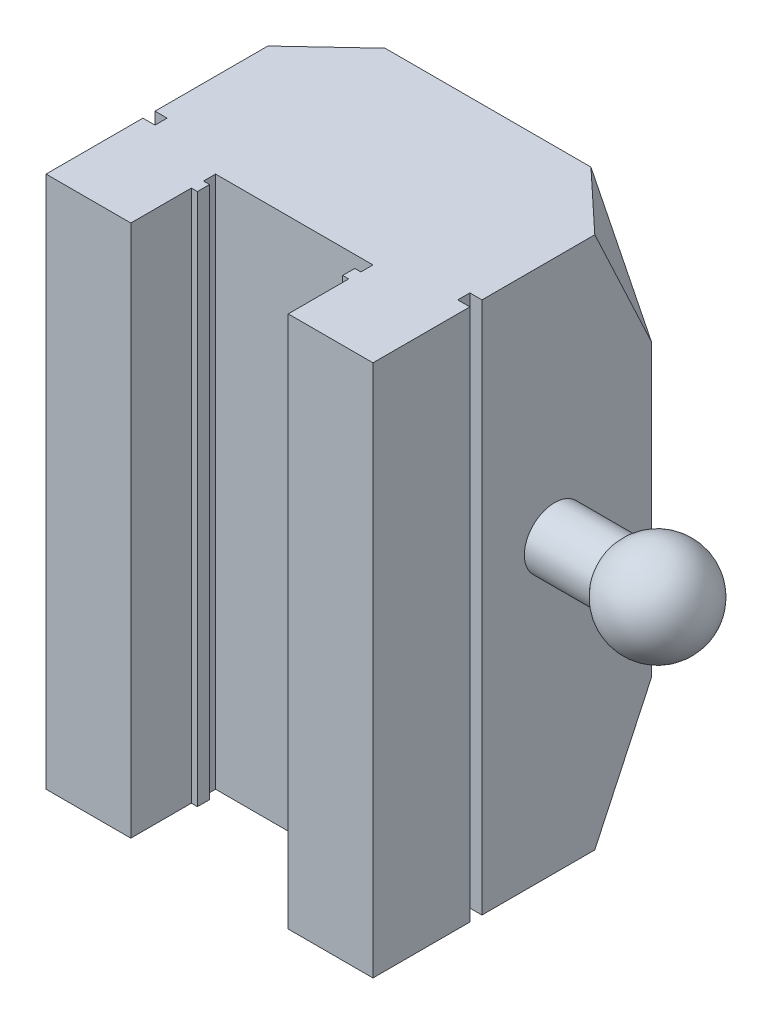
from build123d import *

# Parameters (mm, degrees)
EXTRUDE_1_DEPTH = 44
SKETCH_4_R      = 2.5
EXTRUDE_2_DEPTH = 22


with BuildPart() as part:
    # 草圖1 → 填料-伸長1 (new body)
    with BuildSketch(Plane(origin=(0, 0, 0), x_dir=(1, 0, 0), z_dir=(0, 1, 0))):
        Polygon((-13.5, 0), (-6.5, 0), (-6.5, 5), (-6, 5), (-6, 6), (-6.5, 6), (-6.5, 7), (6.5, 7), (6.5, 6), (6, 6), (6, 5), (6.5, 5), (6.5, 0), (13.5, 0), (13.5, 8), (12.5, 8), (12.5, 9), (13.5, 9), (13.5, 23), (-13.5, 23), (-13.5, 9), (-12.5, 9), (-12.5, 8), (-13.5, 8), align=None)
    extrude(amount=EXTRUDE_1_DEPTH)

    # 除料-掃出1: sweep along a path in 草圖3
    with BuildLine(Plane(origin=(13.5, 0, 0), x_dir=(0, 0, -1), z_dir=(1, 0, 0))) as sweep_1_path:
        Line((23, 34), (18.317914301, 44))
    # 草圖2 → 除料-掃出1 (sweep, cut)
    with BuildSketch(Plane(origin=(0, 0, -23), x_dir=(-1, 0, 0), z_dir=(0, 0, -1))):
        Polygon((-13.5, 44), (-8.5, 44), (-13.5, 34), align=None)
    sweep_1 = sweep(path=sweep_1_path.line, mode=Mode.SUBTRACT)

    # 鏡射1: 除料-掃出1 across plane
    add(sweep_1.mirror(Plane(origin=(0, 0, 0), x_dir=(0, 0, 1), z_dir=(1, 0, 0))), mode=Mode.SUBTRACT)

    # 鏡射2: 除料-掃出1 across plane
    add(sweep_1.mirror(Plane(origin=(0, 22, 0), x_dir=(0, 0, 1), z_dir=(0, -1, 0))), mode=Mode.SUBTRACT)

    # 鏡射2 copy 1: sweep along a path in 鏡射2 copy 1 path
    with BuildLine(Plane(origin=(-13.5, 44, 0), x_dir=(0, 0, -1), z_dir=(-1, 0, 0))) as mirror_2_copy_1_path:
        Line((23, 34), (18.317914301, 44))
    # 鏡射2 copy 1 sketch → 鏡射2 copy 1 (sweep, cut)
    with BuildSketch(Plane(origin=(0, 44, -23), x_dir=(1, 0, 0), z_dir=(0, 0, -1))):
        Polygon((-13.5, 44), (-8.5, 44), (-13.5, 34), align=None)
    sweep(path=mirror_2_copy_1_path.line, mode=Mode.SUBTRACT)

    # 草圖4 → 填料-伸長2 (add, symmetric)
    with BuildSketch(Plane(origin=(0, 0, 0), x_dir=(0, 0, -1), z_dir=(1, 0, 0))):
        with Locations((15, 24)):
            Circle(SKETCH_4_R)
    extrude(amount=EXTRUDE_2_DEPTH, both=True)

    # 草圖5 → 旋轉1 (revolve)
    with BuildSketch(Plane(origin=(22, 0, 0), x_dir=(0, 0, -1), z_dir=(1, 0, 0))):
        with BuildLine():
            Line((15, 28), (15, 20))
            ThreePointArc((15, 20), (19, 24), (15, 28))
        make_face()
    revolve_1 = revolve(axis=Axis((22, 24, -15), (0, 1, 0)))

    # 鏡射3: 旋轉1 across plane
    add(revolve_1.mirror(Plane(origin=(0, 0, 0), x_dir=(0, 0, 1), z_dir=(1, 0, 0))))


solid = part.part
